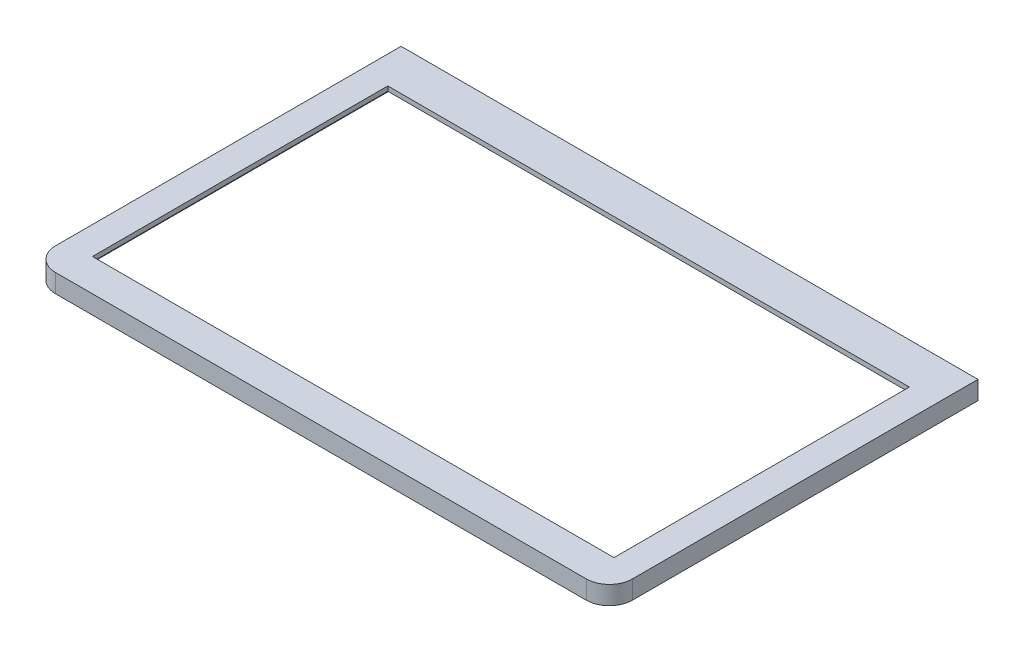
from build123d import *

# Parameters (mm, degrees)
SKETCH_1_W          = 250
SKETCH_1_H          = 156
SKETCH_1_W_2        = 226
SKETCH_1_H_2        = 128
EXTRUDE_1_DEPTH     = 8
SKETCH_2_W          = 235.5
SKETCH_2_H          = 139.5
CUT_EXTRUDE_3_DEPTH = 6
SKETCH_11_W         = 250
SKETCH_11_H         = 8
EXTRUDE_3_DEPTH     = 3.75
CUT_EXTRUDE_4_DEPTH = 10


with BuildPart() as part:
    # 草图1 → 凸台-拉伸1 (new body)
    with BuildSketch(Plane(origin=(0, 0, 0), x_dir=(1, 0, 0), z_dir=(0, 1, 0))):
        with Locations((25.659327926, -14.898030127)):
            Rectangle(SKETCH_1_W, SKETCH_1_H)
        with Locations((25.659327926, -14.898030127)):
            Rectangle(SKETCH_1_W_2, SKETCH_1_H_2, mode=Mode.SUBTRACT)
    extrude(amount=EXTRUDE_1_DEPTH)

    # 草图2 → 切除-拉伸3 (cut)
    with BuildSketch(Plane.XZ):
        with Locations((24.659327926, 12.898030127)):
            Rectangle(SKETCH_2_W, SKETCH_2_H)
    extrude(amount=-CUT_EXTRUDE_3_DEPTH, mode=Mode.SUBTRACT)

    # 草图11 → 凸台-拉伸3 (add)
    with BuildSketch(Plane(origin=(0, 0, -63.101969873), x_dir=(-1, 0, 0), z_dir=(0, 0, -1))):
        with Locations((-25.659327926, 4)):
            Rectangle(SKETCH_11_W, SKETCH_11_H)
    extrude(amount=EXTRUDE_3_DEPTH)

    # 草图12 → 切除-拉伸4 (cut)
    with BuildSketch(Plane(origin=(0, 8, 0), x_dir=(1, 0, 0), z_dir=(0, 1, 0))):
        with BuildLine():
            Line((-99.340672074, -82.898030127), (-99.340672074, -92.898030127))
            Line((-99.340672074, -92.898030127), (-89.340672074, -92.898030127))
            ThreePointArc((-89.340672074, -92.898030127), (-96.411739886, -89.969097939), (-99.340672074, -82.898030127))
        make_face()
        with BuildLine():
            Line((150.659327926, -82.898030127), (150.659327926, -92.898030127))
            Line((150.659327926, -92.898030127), (140.659327926, -92.898030127))
            ThreePointArc((140.659327926, -92.898030127), (147.730395738, -89.969097939), (150.659327926, -82.898030127))
        make_face()
    extrude(amount=-CUT_EXTRUDE_4_DEPTH, mode=Mode.SUBTRACT)


solid = part.part
